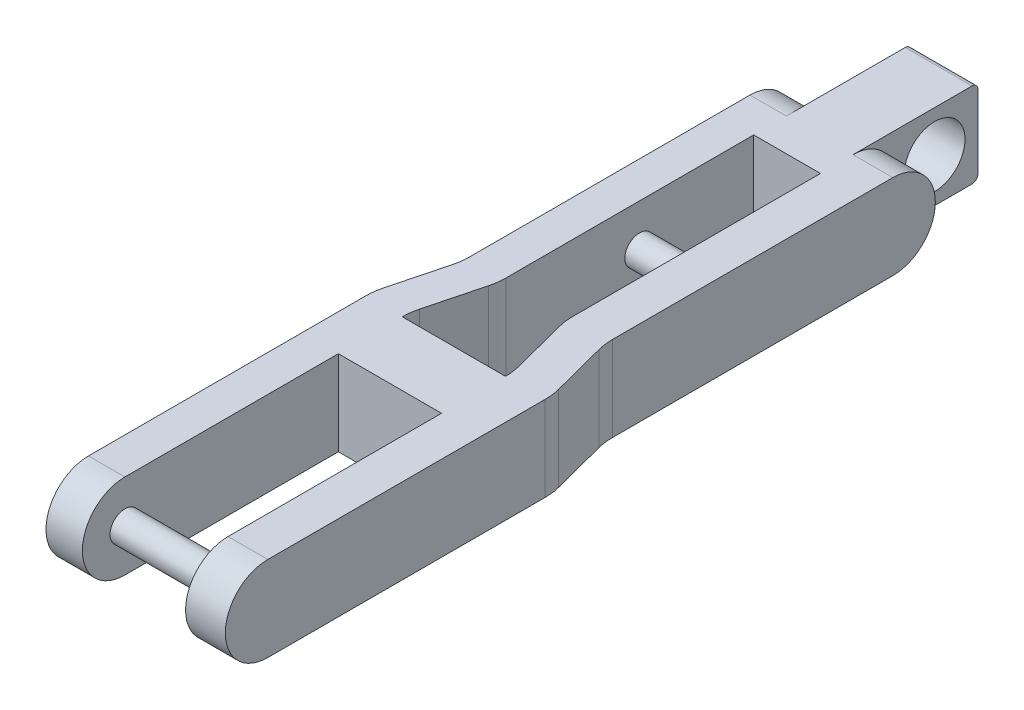
from build123d import *

# Parameters (mm, degrees)
EXTRUDE_2_DEPTH     = 14
FILLET_1_RADIUS     = 7
FILLET_1_LENGTH     = 6.553419282
FILLET_2_RADIUS     = 7
FILLET_2_LENGTH     = 6.553419282
EXTRUDE_3_DEPTH     = 14
FILLET_3_RADIUS     = 7
FILLET_3_LENGTH     = 6
FILLET_4_RADIUS     = 7
FILLET_4_LENGTH     = 6
EXTRUDE_5_REACH     = 125.088
SKETCH_8_R          = 2.45
SKETCH_8_W          = 10.538484084
SKETCH_8_H          = 14
EXTRUDE_6_REACH     = 124.55
SKETCH_11_R         = 2.425
SKETCH_13_W         = 25.960961566
SKETCH_13_H         = 14
EXTRUDE_7_DEPTH     = 11
CUT_EXTRUDE_2_REACH = 137.882
SKETCH_14_R         = 5
FILLET_5_R          = 1


with BuildPart() as part:
    # 草图1 → 凸台-拉伸2 (new body)
    with BuildSketch(Plane(origin=(0, 0, 0), x_dir=(1, 0, 0), z_dir=(0, 1, 0))):
        with BuildLine():
            Line((5, 0), (5, 52.718048915))
            ThreePointArc((5, 52.718048915), (4.918829182, 53.989594298), (4.676634468, 55.240497206))
            Line((4.676634468, 55.240497206), (2.323365532, 64.268124597))
            ThreePointArc((2.323365532, 64.268124597), (2.081170818, 65.519027505), (2, 66.790572889))
            Line((2, 66.790572889), (2, 120))
            Line((2, 120), (-4.553419282, 120))
            Line((-4.553419282, 120), (-4.553419282, 66.790572889))
            ThreePointArc((-4.553419282, 66.790572889), (-4.472248464, 65.519027505), (-4.23005375, 64.268124597))
            Line((-4.23005375, 64.268124597), (-1.876784815, 55.240497206))
            ThreePointArc((-1.876784815, 55.240497206), (-1.6345901, 53.989594298), (-1.553419282, 52.718048915))
            Line((-1.553419282, 52.718048915), (-1.553419282, 0))
            Line((-1.553419282, 0), (5, 0))
        make_face()
    extrude(amount=EXTRUDE_2_DEPTH)

    # 圆角1: full round fillet: the end face becomes a half cylinder, R = half its width
    fillet_1_face = Plane((1.723290359, 7, 0), x_dir=(1, 0, 0), z_dir=(0, 0, 1))  # on the end face: x along it, z out of the body
    fillet_1_slab = fillet_1_face.offset(-FILLET_1_RADIUS / 2) * Box(FILLET_1_LENGTH, 2 * FILLET_1_RADIUS, FILLET_1_RADIUS, mode=Mode.PRIVATE)  # the body's end, R deep
    fillet_1_round = Plane((1.723290359, 7, -7), x_dir=(0, 0, 1), z_dir=(1, 0, 0)) * Cylinder(FILLET_1_RADIUS, FILLET_1_LENGTH, mode=Mode.PRIVATE)  # its axis R under the face
    add(fillet_1_slab - fillet_1_round, mode=Mode.SUBTRACT)

    # 圆角2: full round fillet: the end face becomes a half cylinder, R = half its width
    fillet_2_face = Plane((-1.276709641, 7, -120), x_dir=(-1, 0, 0), z_dir=(0, 0, -1))  # on the end face: x along it, z out of the body
    fillet_2_slab = fillet_2_face.offset(-FILLET_2_RADIUS / 2) * Box(FILLET_2_LENGTH, 2 * FILLET_2_RADIUS, FILLET_2_RADIUS, mode=Mode.PRIVATE)  # the body's end, R deep
    fillet_2_round = Plane((-1.276709641, 7, -113), x_dir=(0, 0, -1), z_dir=(-1, 0, 0)) * Cylinder(FILLET_2_RADIUS, FILLET_2_LENGTH, mode=Mode.PRIVATE)  # its axis R under the face
    add(fillet_2_slab - fillet_2_round, mode=Mode.SUBTRACT)

    # 草图8 → 凸台-拉伸5 (add, up to next)
    with BuildSketch(Plane(origin=(-18.553419282, 0, 0), x_dir=(0, 0, -1), z_dir=(1, 0, 0)), mode=Mode.PRIVATE) as extrude_5_sk1:
        with Locations(Location((7, 7, 0), (0, 0, 180))):
            Circle(SKETCH_8_R)
    extrude_5_tool1 = extrude(extrude_5_sk1.sketch, amount=EXTRUDE_5_REACH, mode=Mode.PRIVATE) - part.part
    # 草图8 → 凸台-拉伸5 (add, up to next)
    with BuildSketch(Plane(origin=(-18.553419282, 0, 0), x_dir=(0, 0, -1), z_dir=(1, 0, 0)), mode=Mode.PRIVATE) as extrude_5_sk2:
        with Locations((47.448806873, 7)):
            Rectangle(SKETCH_8_W, SKETCH_8_H)
    extrude_5_tool2 = extrude(extrude_5_sk2.sketch, amount=EXTRUDE_5_REACH, mode=Mode.PRIVATE) - part.part


with BuildPart() as body_2:
    # 草图4 → 凸台-拉伸3 (new body)
    with BuildSketch(Plane(origin=(0, 0, 0), x_dir=(1, 0, 0), z_dir=(0, 1, 0))):
        with BuildLine():
            Line((-18.553419282, 0), (-24.553419282, 0))
            Line((-24.553419282, 0), (-24.553419282, 52.718048915))
            ThreePointArc((-24.553419282, 52.718048915), (-24.472248464, 53.989594298), (-24.23005375, 55.240497206))
            Line((-24.23005375, 55.240497206), (-21.876784815, 64.268124597))
            ThreePointArc((-21.876784815, 64.268124597), (-21.6345901, 65.519027505), (-21.553419282, 66.790572889))
            Line((-21.553419282, 66.790572889), (-21.553419282, 120))
            Line((-21.553419282, 120), (-15.553419282, 120))
            Line((-15.553419282, 120), (-15.553419282, 66.790572889))
            ThreePointArc((-15.553419282, 66.790572889), (-15.6345901, 65.519027505), (-15.876784815, 64.268124597))
            Line((-15.876784815, 64.268124597), (-18.23005375, 55.240497206))
            ThreePointArc((-18.23005375, 55.240497206), (-18.472248464, 53.989594298), (-18.553419282, 52.718048915))
            Line((-18.553419282, 52.718048915), (-18.553419282, 0))
        make_face()
    extrude(amount=EXTRUDE_3_DEPTH)

    # 圆角3: full round fillet: the end face becomes a half cylinder, R = half its width
    fillet_3_face = Plane((-18.553419282, 7, -120), x_dir=(-1, 0, 0), z_dir=(0, 0, -1))  # on the end face: x along it, z out of the body
    fillet_3_slab = fillet_3_face.offset(-FILLET_3_RADIUS / 2) * Box(FILLET_3_LENGTH, 2 * FILLET_3_RADIUS, FILLET_3_RADIUS, mode=Mode.PRIVATE)  # the body's end, R deep
    fillet_3_round = Plane((-18.553419282, 7, -113), x_dir=(0, 0, -1), z_dir=(-1, 0, 0)) * Cylinder(FILLET_3_RADIUS, FILLET_3_LENGTH, mode=Mode.PRIVATE)  # its axis R under the face
    add(fillet_3_slab - fillet_3_round, mode=Mode.SUBTRACT)

    # 圆角4: full round fillet: the end face becomes a half cylinder, R = half its width
    fillet_4_face = Plane((-21.553419282, 7, 0), x_dir=(1, 0, 0), z_dir=(0, 0, 1))  # on the end face: x along it, z out of the body
    fillet_4_slab = fillet_4_face.offset(-FILLET_4_RADIUS / 2) * Box(FILLET_4_LENGTH, 2 * FILLET_4_RADIUS, FILLET_4_RADIUS, mode=Mode.PRIVATE)  # the body's end, R deep
    fillet_4_round = Plane((-21.553419282, 7, -7), x_dir=(0, 0, 1), z_dir=(1, 0, 0)) * Cylinder(FILLET_4_RADIUS, FILLET_4_LENGTH, mode=Mode.PRIVATE)  # its axis R under the face
    add(fillet_4_slab - fillet_4_round, mode=Mode.SUBTRACT)


with BuildPart() as part_1:
    add(part.part)

    add(body_2.part)  # 凸台-拉伸5 merges body 2
    add(extrude_5_tool1.solids().sort_by_distance((-18.553419, 7, -7))[0])
    add(extrude_5_tool2.solids().sort_by_distance((-18.553419, 7, -47.448807))[0])

    # 草图11 → 凸台-拉伸6 (add, up to next)
    with BuildSketch(Plane(origin=(-15.553419282, 0, 0), x_dir=(0, 0, -1), z_dir=(1, 0, 0)), mode=Mode.PRIVATE) as extrude_6_sk1:
        with Locations(Location((88.803678257, 7, 0), (0, 0, 180))):
            Circle(SKETCH_11_R)
    extrude_6_tool1 = extrude(extrude_6_sk1.sketch, amount=EXTRUDE_6_REACH, mode=Mode.PRIVATE) - part_1.part
    add(extrude_6_tool1.solids().sort_by_distance((-15.553419, 7, -88.803678))[0])

    # 草图13 → 凸台-拉伸7 (add)
    with BuildSketch(Plane(origin=(-15.553419282, 0, 0), x_dir=(0, 0, -1), z_dir=(1, 0, 0))):
        with Locations((120.606040711, 7)):
            Rectangle(SKETCH_13_W, SKETCH_13_H)
    extrude(amount=EXTRUDE_7_DEPTH)

    # 草图14 → 切除-拉伸2 (cut, up to next)
    with BuildSketch(Plane.ZY.offset(15.553419282), mode=Mode.PRIVATE) as cut_extrude_2_sk1:
        with Locations((-126.442783906, 7)):
            Circle(SKETCH_14_R)
    cut_extrude_2_tool1 = extrude(cut_extrude_2_sk1.sketch, amount=-CUT_EXTRUDE_2_REACH, mode=Mode.PRIVATE) & part_1.part
    add(cut_extrude_2_tool1.solids().sort_by_distance((-15.553419, 7, -126.442784))[0], mode=Mode.SUBTRACT)

    # 圆角5
    fillet_5_edges = [part_1.edges().sort_by_distance(p)[0] for p in [
        (-10.053419282, 0, -133.586521494),
        (-10.053419282, 14, -133.586521494),
    ]]
    fillet(fillet_5_edges, radius=FILLET_5_R)


solid = part_1.part
